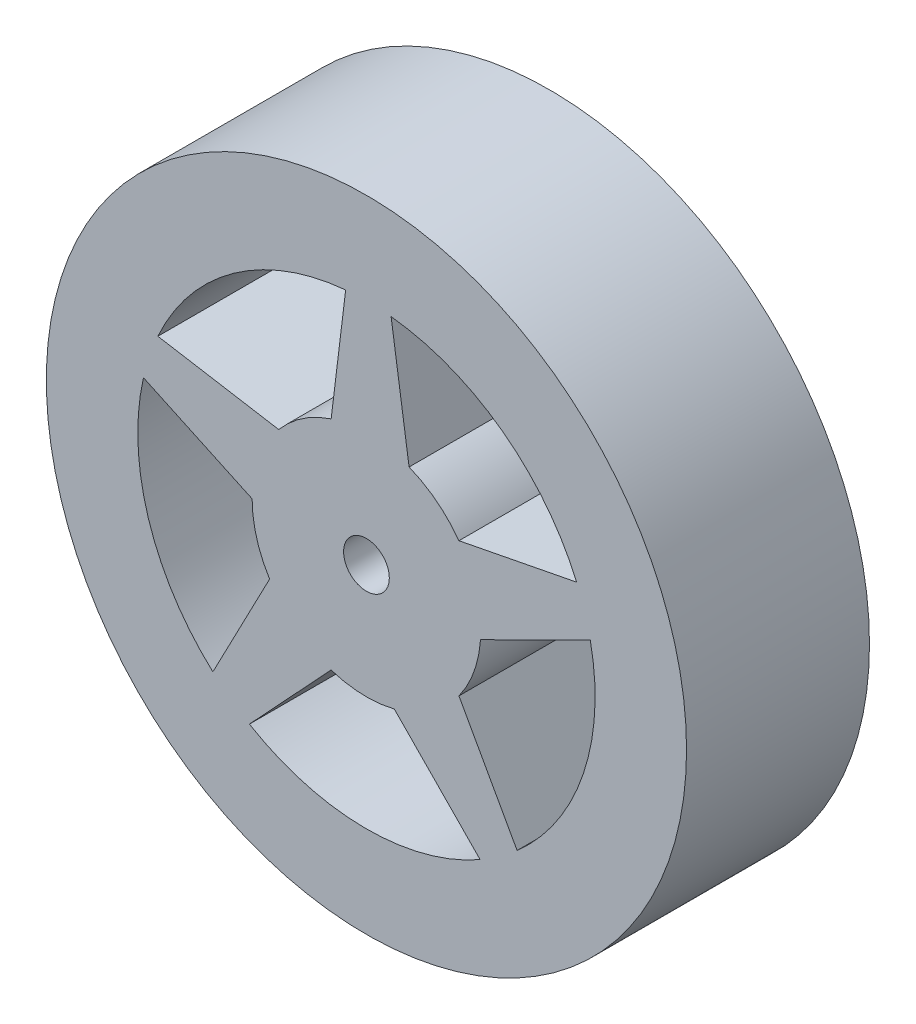
from build123d import *

# Parameters (mm, degrees)
SKETCH_1_R               = 35
SKETCH_1_R_2             = 25
EXTRUDE_1_DEPTH          = 10
SKETCH_2_R               = 12.5
EXTRUDE_2_DEPTH          = 10
PATTERN_CIRCULAR_1_COUNT = 5
SKETCH_3_R               = 2.5
CUT_EXTRUDE_1_DEPTH      = 54.38539126
CUT_EXTRUDE_2_DEPTH      = 10


with BuildPart() as part:
    # 草图1 → 凸台-拉伸1 (new, symmetric)
    with BuildSketch(Plane.XY):
        Circle(SKETCH_1_R)
        Circle(SKETCH_1_R_2, mode=Mode.SUBTRACT)
    extrude(amount=EXTRUDE_1_DEPTH, both=True)

    # 草图2 → 凸台-拉伸2 (add, symmetric)
    with BuildSketch(Plane.XY):
        Circle(SKETCH_2_R)
        with BuildLine():
            Line((-1.438766033, 31.712801318), (-3.859353097, 11.889297443))
            ThreePointArc((-3.859353097, 11.889297443), (0.427174783, 12.492698736), (4.662473362, 11.597902489))
            Line((4.662473362, 11.597902489), (1.678560372, 31.712801318))
            Line((1.678560372, 31.712801318), (-1.438766033, 31.712801318))
        make_face()
    extrude_2 = extrude(amount=EXTRUDE_2_DEPTH, both=True)

    # 阵列(圆周)1: 凸台-拉伸2 ×5 about axis
    pattern_circular_1_axis = Axis((0, 0, 0), (0, 0, 1))
    for i in range(1, PATTERN_CIRCULAR_1_COUNT):
        add(extrude_2.rotate(pattern_circular_1_axis, i * 360 / PATTERN_CIRCULAR_1_COUNT))

    # 草图3 → 切除-拉伸1 (cut, through all)
    with BuildSketch(Plane.XY.offset(10)):
        Circle(SKETCH_3_R)
    extrude(amount=-CUT_EXTRUDE_1_DEPTH, mode=Mode.SUBTRACT)

    # 草图4 → 切除-拉伸2 (cut)
    with BuildSketch(Plane(origin=(0, 0, -10), x_dir=(-1, 0, 0), z_dir=(0, 0, -1))):
        Polygon((0, 8), (-6.92820323, 4), (-6.92820323, -4), (0, -8), (6.92820323, -4), (6.92820323, 4), align=None)
    extrude(amount=-CUT_EXTRUDE_2_DEPTH, mode=Mode.SUBTRACT)


solid = part.part
